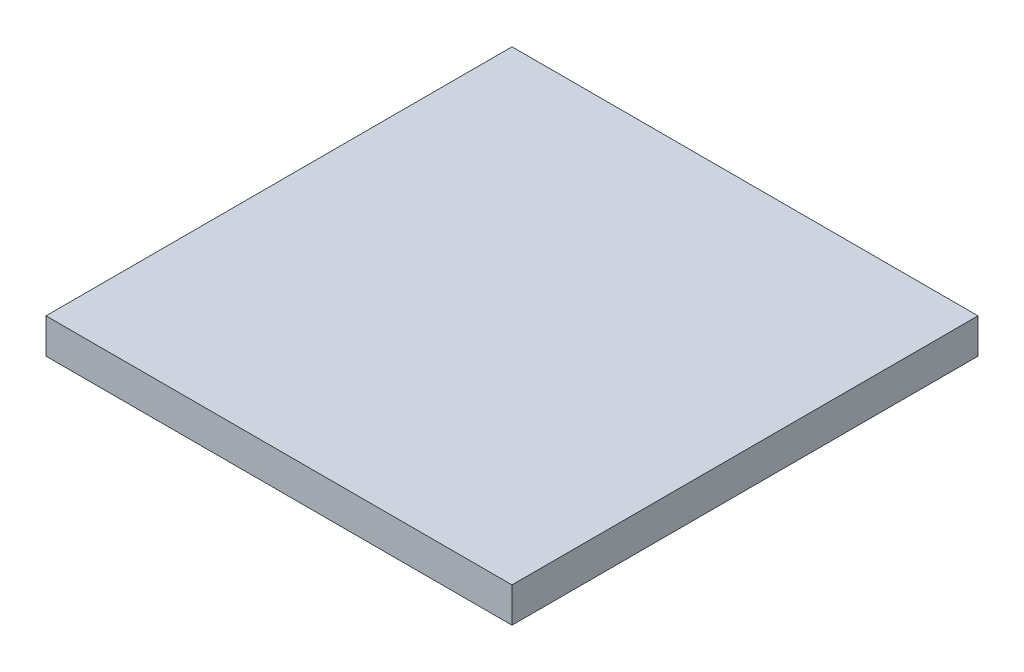
from build123d import *

# Parameters (mm, degrees)
SKETCH1_W           = 101.6
SKETCH1_H           = 101.6
BOSS_EXTRUDE1_DEPTH = 7.62


with BuildPart() as part:
    # Sketch1 → Boss-Extrude1 (new body)
    with BuildSketch(Plane(origin=(0, 0, 0), x_dir=(1, 0, 0), z_dir=(0, 1, 0))):
        with Locations((50.8, -50.8)):
            Rectangle(SKETCH1_W, SKETCH1_H)
    extrude(amount=BOSS_EXTRUDE1_DEPTH)


solid = part.part
